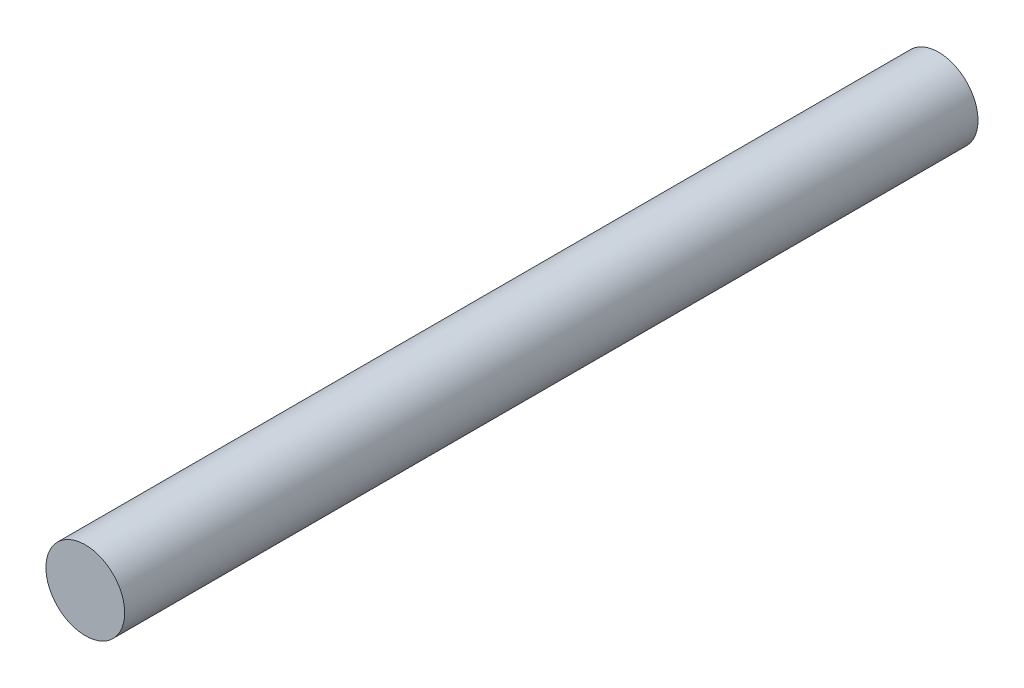
from build123d import *

# Parameters (mm, degrees)
ESBO_O1_R                = 6
RESSALTO_EXTRUS_O1_DEPTH = 130


with BuildPart() as part:
    # Esboço1 → Ressalto-extrusão1 (new body)
    with BuildSketch(Plane.XY):
        Circle(ESBO_O1_R)
    extrude(amount=RESSALTO_EXTRUS_O1_DEPTH)


solid = part.part
